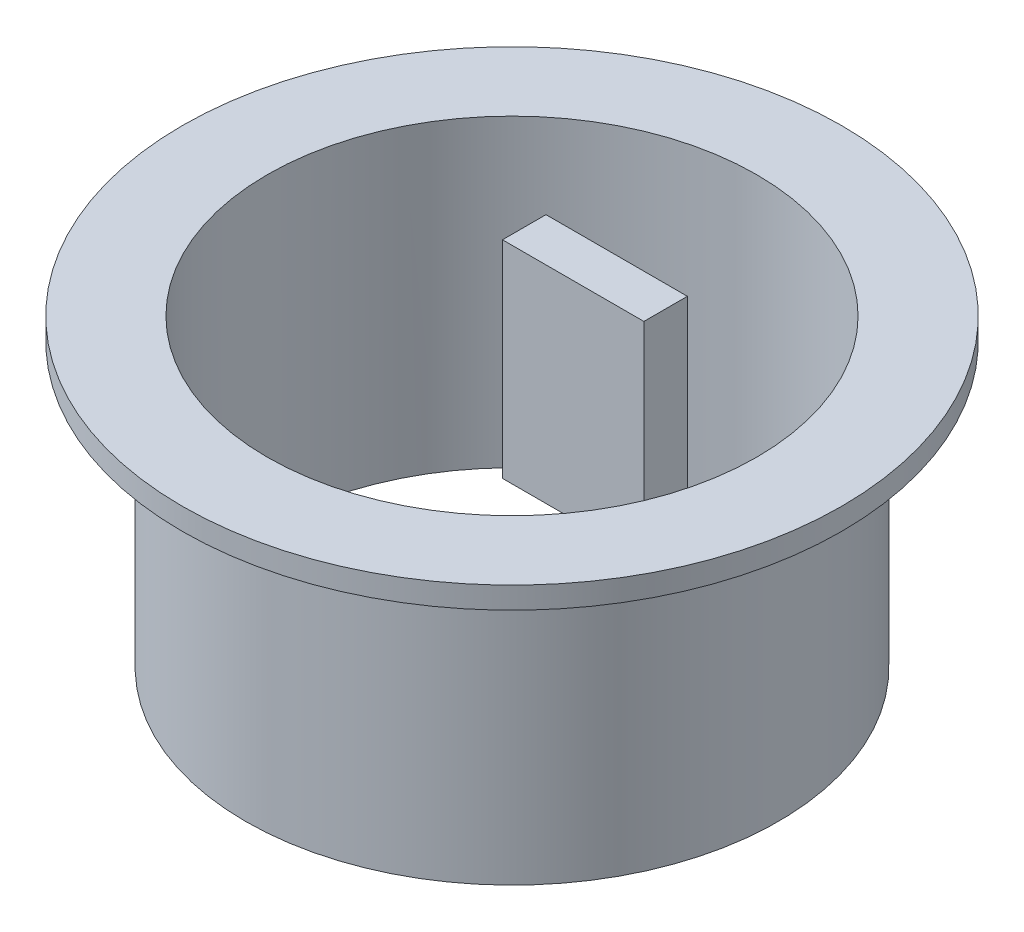
from build123d import *

# Parameters (mm, degrees)
SKETCH_1_R      = 60.625
SKETCH_1_R_2    = 45
EXTRUDE_1_DEPTH = 4
EXTRUDE_START   = 52
SKETCH_8_R      = 49
SKETCH_8_R_2    = 45
EXTRUDE_3_DEPTH = 52
SKETCH_9_W      = 15
SKETCH_9_H      = 8
EXTRUDE_4_DEPTH = 13
SKETCH_9_3_W    = 8
SKETCH_9_3_H    = 38
EXTRUDE_5_DEPTH = 13
EXTRUDE_6_DEPTH = 13


with BuildPart() as part:
    # 草图1 → 凸台-拉伸1 (new body)
    with BuildSketch(Plane(origin=(0, 0, 0), x_dir=(1, 0, 0), z_dir=(0, 1, 0))):
        Circle(SKETCH_1_R)
        Circle(SKETCH_1_R_2, mode=Mode.SUBTRACT)
    extrude(amount=EXTRUDE_1_DEPTH)

    # 草图8 → 凸台-拉伸3 (add)
    with BuildSketch(Plane.XZ.offset(EXTRUDE_START)):
        Circle(SKETCH_8_R)
        Circle(SKETCH_8_R_2, mode=Mode.SUBTRACT)
    extrude(amount=-EXTRUDE_3_DEPTH)

    # 草图9 → 凸台-拉伸4 (add, symmetric)
    with BuildSketch(Plane(origin=(0, 0, 0), x_dir=(0, 0, -1), z_dir=(1, 0, 0))):
        with Locations((-39.25, -30)):
            Rectangle(SKETCH_9_W, SKETCH_9_H)
    extrude(amount=EXTRUDE_4_DEPTH, both=True)

    # 草图9<8> → 凸台-拉伸6 (add, symmetric)
    with BuildSketch(Plane(origin=(0, 0, 0), x_dir=(0, 0, -1), z_dir=(1, 0, 0))):
        Polygon((-31.75, -26), (-45, -24), (-45, -26), align=None)
    extrude(amount=EXTRUDE_6_DEPTH, both=True)


with BuildPart() as body_2:
    # 草图9<3> → 凸台-拉伸5 (new, symmetric)
    with BuildSketch(Plane(origin=(0, 0, 0), x_dir=(0, 0, -1), z_dir=(1, 0, 0))):
        with Locations((15.25, -15)):
            Rectangle(SKETCH_9_3_W, SKETCH_9_3_H)
    extrude(amount=EXTRUDE_5_DEPTH, both=True)


solid = Compound([part.part, body_2.part])
